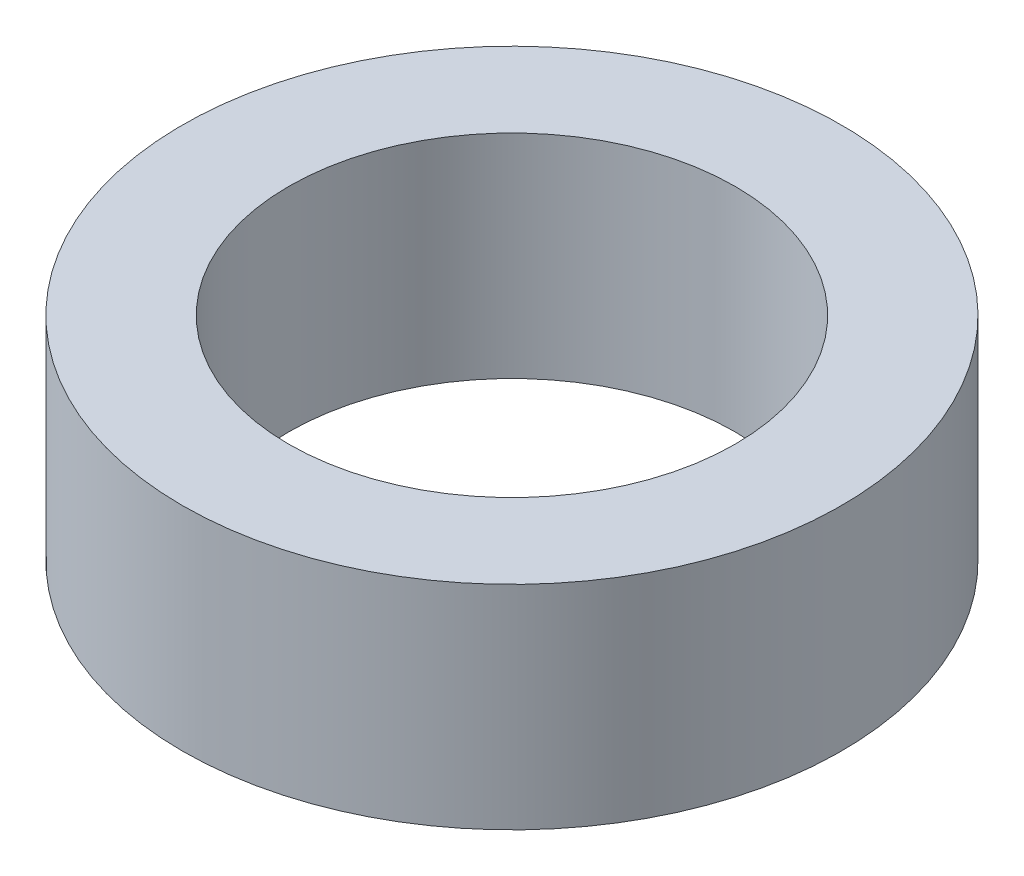
from build123d import *

# Parameters (mm, degrees)
SKETCH1_R           = 3.937
SKETCH1_R_2         = 2.667
BOSS_EXTRUDE1_DEPTH = 2.54


with BuildPart() as part:
    # Sketch1 → Boss-Extrude1 (new body)
    with BuildSketch(Plane(origin=(0, 0, 0), x_dir=(1, 0, 0), z_dir=(0, 1, 0))):
        with Locations(Location((0, 0, 0), (0, 0, 270))):
            Circle(SKETCH1_R)
        with Locations(Location((0, 0, 0), (0, 0, 270))):
            Circle(SKETCH1_R_2, mode=Mode.SUBTRACT)
    extrude(amount=BOSS_EXTRUDE1_DEPTH)


solid = part.part
